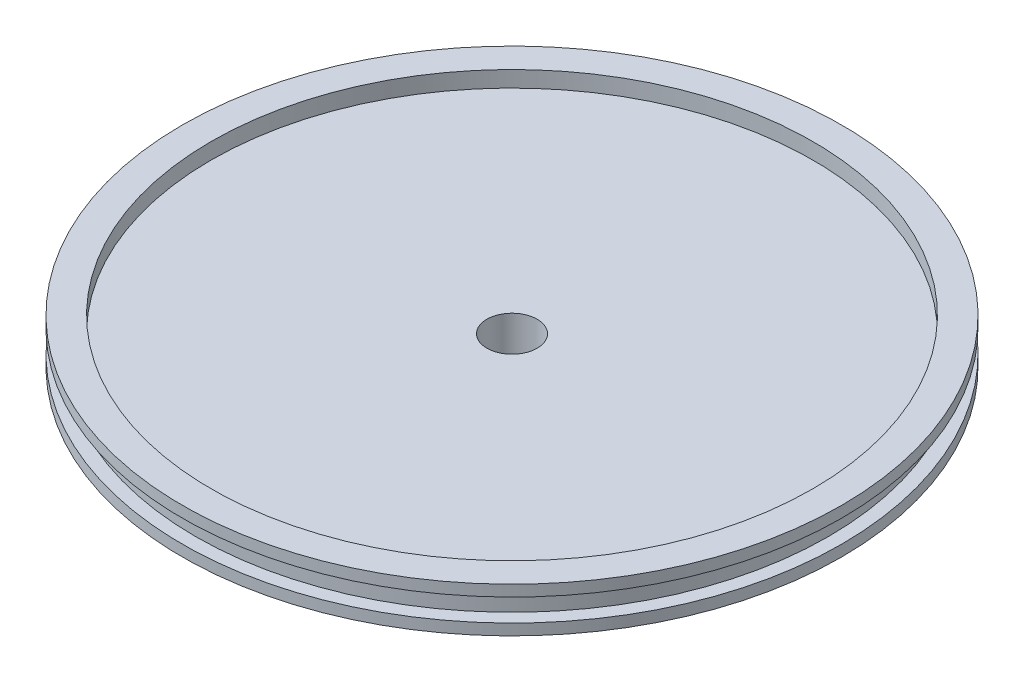
from build123d import *

# Parameters (mm, degrees)
SKETCH6_R                        = 66.04
BOSS_EXTRUDE1_DEPTH              = 2.54
PIPE_TAP_DRILL_FOR_1_4_TAP_GN2_D = 11.1252


with BuildPart() as part:
    # Sketch1 → Revolve1 (revolve)
    with BuildSketch(Plane.XY, mode=Mode.PRIVATE) as revolve1_sk:
        Polygon((0, 0), (72.898, 0), (72.898, 2.4638), (69.977, 2.4638), (69.977, 7.4422), (72.898, 7.4422), (72.898, 9.906), (66.548, 9.906), (66.548, 6.35), (0, 6.35), align=None)
    revolve(revolve1_sk.sketch.rotate(Axis((0, 48.192213231, 0), (0, -1, 0)), 180), axis=Axis((0, 48.192213231, 0), (0, -1, 0)))

    # Sketch6 → Boss-Extrude1 (add)
    with BuildSketch(Plane.XZ):
        Circle(SKETCH6_R)
    extrude(amount=BOSS_EXTRUDE1_DEPTH)

    # Pipe Tap Drill for 1/4 Tap - GN2 (through all)
    with Locations(Plane(origin=(0, 6.35, 0), x_dir=(1, 0, 0), z_dir=(0, 1, 0))):
        with Locations((0, 0)):
            Hole(PIPE_TAP_DRILL_FOR_1_4_TAP_GN2_D / 2)


solid = part.part
